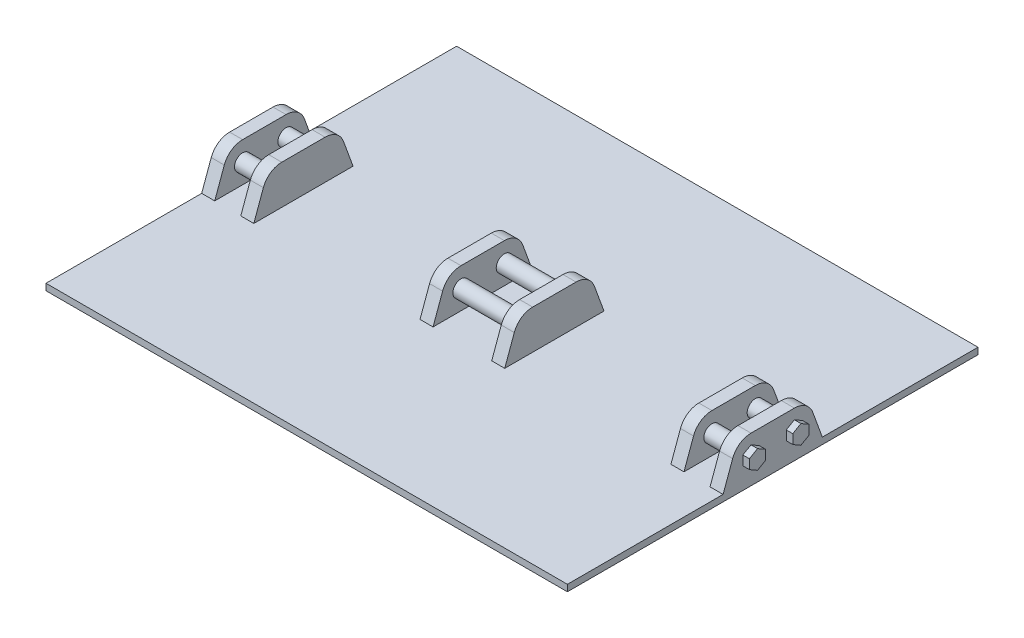
from build123d import *

# Parameters (mm, degrees)
CROQUIS1_W              = 800
CROQUIS1_H              = 630
SALIENTE_EXTRUIR1_DEPTH = 10
SALIENTE_EXTRUIR3_DEPTH = 20
SALIENTE_EXTRUIR4_DEPTH = 10
CROQUIS5_R              = 12.5
SALIENTE_EXTRUIR5_DEPTH = 40
SALIENTE_EXTRUIR6_DEPTH = 20
CROQUIS7_W              = 20
CROQUIS7_H              = 152.276428112
SALIENTE_EXTRUIR7_DEPTH = 60
CORTAR_EXTRUIR1_DEPTH   = 140
CROQUIS9_R              = 12.5
SALIENTE_EXTRUIR8_DEPTH = 111


with BuildPart() as part:
    # Croquis1 → Saliente-Extruir1 (new body)
    with BuildSketch(Plane(origin=(0, 0, 0), x_dir=(1, 0, 0), z_dir=(0, 1, 0))):
        Rectangle(CROQUIS1_W, CROQUIS1_H)
    extrude(amount=SALIENTE_EXTRUIR1_DEPTH)

    # Croquis2 → Saliente-Extruir3 (add)
    with BuildSketch(Plane(origin=(400, 0, 0), x_dir=(0, 0, -1), z_dir=(1, 0, 0))):
        with BuildLine():
            Line((-33.293773854, 70), (33.293773854, 70))
            ThreePointArc((33.293773854, 70), (50.501066944, 64.574561329), (61.484552477, 50.2606043))
            Line((61.484552477, 50.2606043), (76.138214056, 10))
            Line((76.138214056, 10), (-76.138214056, 10))
            Line((-76.138214056, 10), (-61.484552477, 50.2606043))
            ThreePointArc((-61.484552477, 50.2606043), (-50.501066944, 64.574561329), (-33.293773854, 70))
        make_face()
    saliente_extruir3 = extrude(amount=-SALIENTE_EXTRUIR3_DEPTH)

    # Croquis4 → Saliente-Extruir4 (add)
    with BuildSketch(Plane(origin=(400, 0, 0), x_dir=(0, 0, -1), z_dir=(1, 0, 0))):
        Polygon((-33.293773854, 54.43375673), (-45.793773854, 47.216878365), (-45.793773854, 32.783121635), (-33.293773854, 25.56624327), (-20.793773854, 32.783121635), (-20.793773854, 47.216878365), align=None)
        Polygon((33.293773854, 54.43375673), (20.793773854, 47.216878365), (20.793773854, 32.783121635), (33.293773854, 25.56624327), (45.793773854, 32.783121635), (45.793773854, 47.216878365), align=None)
    saliente_extruir4 = extrude(amount=SALIENTE_EXTRUIR4_DEPTH)

    # Simetría1: Saliente-Extruir3, Saliente-Extruir4 across plane
    add(saliente_extruir3.mirror(Plane(origin=(0, 0, 0), x_dir=(0, 0, 1), z_dir=(1, 0, 0))))
    add(saliente_extruir4.mirror(Plane(origin=(0, 0, 0), x_dir=(0, 0, 1), z_dir=(1, 0, 0))))

    # Croquis5 → Saliente-Extruir5 (add)
    with BuildSketch(Plane(origin=(-380, 0, 0), x_dir=(0, 0, -1), z_dir=(1, 0, 0))):
        with Locations((-33.293773854, 40)):
            Circle(CROQUIS5_R)
        with Locations((33.293773854, 40)):
            Circle(CROQUIS5_R)
    saliente_extruir5 = extrude(amount=SALIENTE_EXTRUIR5_DEPTH)

    # Croquis6 → Saliente-Extruir6 (add)
    with BuildSketch(Plane(origin=(-340, 0, 0), x_dir=(0, 0, -1), z_dir=(1, 0, 0))):
        with BuildLine():
            Line((-76.138214056, 10), (76.138214056, 10))
            Line((76.138214056, 10), (61.484552477, 50.2606043))
            ThreePointArc((61.484552477, 50.2606043), (50.501066944, 64.574561329), (33.293773854, 70))
            Line((33.293773854, 70), (-33.293773854, 70))
            ThreePointArc((-33.293773854, 70), (-50.501066944, 64.574561329), (-61.484552477, 50.2606043))
            Line((-61.484552477, 50.2606043), (-76.138214056, 10))
        make_face()
    saliente_extruir6 = extrude(amount=SALIENTE_EXTRUIR6_DEPTH)

    # Simetría2: Saliente-Extruir5, Saliente-Extruir6 across plane
    add(saliente_extruir5.mirror(Plane(origin=(0, 0, 0), x_dir=(0, 0, 1), z_dir=(1, 0, 0))))
    add(saliente_extruir6.mirror(Plane(origin=(0, 0, 0), x_dir=(0, 0, 1), z_dir=(1, 0, 0))))

    # Croquis7 → Saliente-Extruir7 (add)
    with BuildSketch(Plane(origin=(0, 10, 0), x_dir=(1, 0, 0), z_dir=(0, 1, 0))):
        with Locations((-55, 0)):
            Rectangle(CROQUIS7_W, CROQUIS7_H)
        with Locations((55, 0)):
            Rectangle(CROQUIS7_W, CROQUIS7_H)
    extrude(amount=SALIENTE_EXTRUIR7_DEPTH)

    # Croquis8 → Cortar-Extruir1 (cut)
    with BuildSketch(Plane(origin=(65, 0, 0), x_dir=(0, 0, -1), z_dir=(1, 0, 0))):
        with BuildLine():
            ThreePointArc((-61.484552477, 50.2606043), (-50.501066944, 64.574561329), (-33.293773854, 70))
            Line((-33.293773854, 70), (-76.138214056, 70))
            Line((-76.138214056, 70), (-76.138214056, 10))
            Line((-76.138214056, 10), (-61.484552477, 50.2606043))
        make_face()
        with BuildLine():
            Line((61.484552477, 50.2606043), (76.138214056, 10))
            Line((76.138214056, 10), (76.138214056, 70))
            Line((76.138214056, 70), (33.293773854, 70))
            ThreePointArc((33.293773854, 70), (50.501066944, 64.574561329), (61.484552477, 50.2606043))
        make_face()
    extrude(amount=-CORTAR_EXTRUIR1_DEPTH, mode=Mode.SUBTRACT)

    # Croquis9 → Saliente-Extruir8 (add)
    with BuildSketch(Plane(origin=(65, 0, 0), x_dir=(0, 0, -1), z_dir=(1, 0, 0))):
        with Locations((33.293773854, 40)):
            Circle(CROQUIS9_R)
        with Locations((-33.293773854, 40)):
            Circle(CROQUIS9_R)
    extrude(amount=-SALIENTE_EXTRUIR8_DEPTH)


solid = part.part
